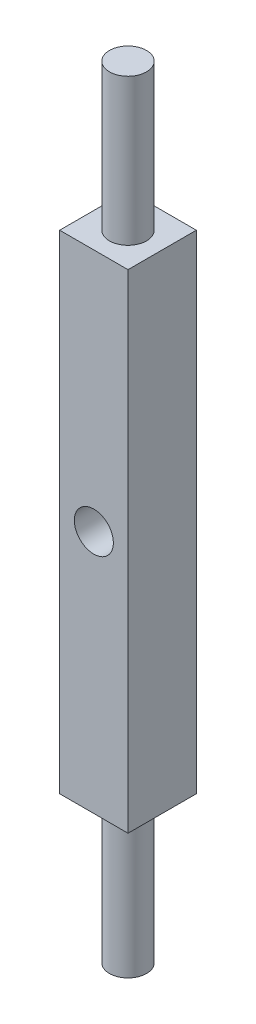
from build123d import *

# Parameters (mm, degrees)
SKETCH2_W                = 7
SKETCH2_H                = 7
BOSS_EXTRUDE1_DEPTH      = 50
BOSS_EXTRUDE3_DEPTH      = 15
BOSS_EXTRUDE3_DEPTH_BACK = 65
SKETCH3_R                = 1.9
SKETCH4_R                = 2
CUT_EXTRUDE1_DEPTH       = 10


with BuildPart() as part:
    # Sketch2 → Boss-Extrude1 (new body)
    with BuildSketch(Plane(origin=(0, 0, 0), x_dir=(1, 0, 0), z_dir=(0, 1, 0))):
        Rectangle(SKETCH2_W, SKETCH2_H)
    extrude(amount=BOSS_EXTRUDE1_DEPTH)

    # Sketch3 → Boss-Extrude3 (add, two sides: drawn at the far end of the back side and taken through both)
    with BuildSketch(Plane.XZ.offset(-BOSS_EXTRUDE3_DEPTH_BACK)):
        with Locations(Location((0, 0, 0), (0, 0, 270))):
            Circle(SKETCH3_R)
    extrude(amount=BOSS_EXTRUDE3_DEPTH + BOSS_EXTRUDE3_DEPTH_BACK)

    # Sketch4 → Cut-Extrude1 (cut)
    with BuildSketch(Plane.XY.offset(3.5)):
        with Locations((0, 25.010433152)):
            Circle(SKETCH4_R)
    extrude(amount=-CUT_EXTRUDE1_DEPTH, mode=Mode.SUBTRACT)


solid = part.part
